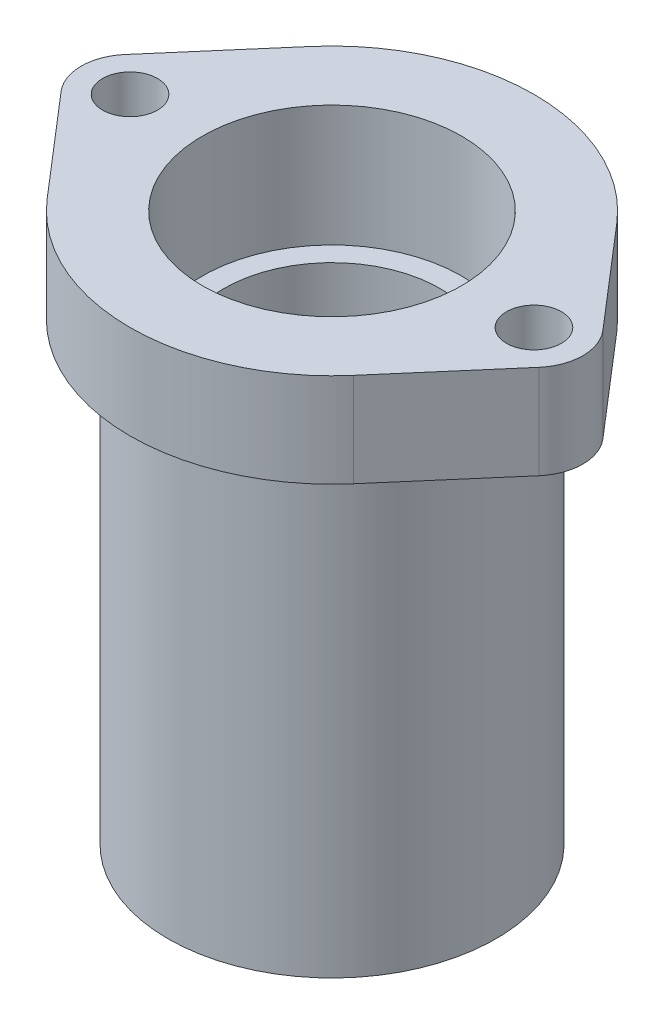
from build123d import *

# Parameters (mm, degrees)
SKETCH1_R           = 1.7272
BOSS_EXTRUDE1_DEPTH = 5.9055
SKETCH2_R           = 10.31875
BOSS_EXTRUDE2_DEPTH = 28.575
SKETCH3_R           = 8.1534
CUT_EXTRUDE1_DEPTH  = 7.62
SKETCH4_R           = 6.7945
CUT_EXTRUDE2_DEPTH  = 16.256
SKETCH5_R           = 5.08
CUT_EXTRUDE3_DEPTH  = 40.987435874


with BuildPart() as part:
    # Sketch1 → Boss-Extrude1 (new body)
    with BuildSketch(Plane(origin=(0, 0, 0), x_dir=(1, 0, 0), z_dir=(0, 1, 0))):
        with BuildLine():
            Line((-15.0296372, 2.004639139), (-9.6266, 8.283632805))
            ThreePointArc((-9.6266, 8.283632805), (0, 12.7), (9.6266, 8.283632805))
            Line((9.6266, 8.283632805), (15.0296372, 2.004639139))
            ThreePointArc((15.0296372, 2.004639139), (15.7734, 0), (15.0296372, -2.004639139))
            Line((15.0296372, -2.004639139), (9.6266, -8.283632805))
            ThreePointArc((9.6266, -8.283632805), (0, -12.7), (-9.6266, -8.283632805))
            Line((-9.6266, -8.283632805), (-15.0296372, -2.004639139))
            ThreePointArc((-15.0296372, -2.004639139), (-15.7734, 0), (-15.0296372, 2.004639139))
        make_face()
        with Locations(Location((-12.7, 0, 0), (0, 0, 270))):
            Circle(SKETCH1_R, mode=Mode.SUBTRACT)
        with Locations(Location((12.7, 0, 0), (0, 0, 270))):
            Circle(SKETCH1_R, mode=Mode.SUBTRACT)
    extrude(amount=BOSS_EXTRUDE1_DEPTH)

    # Sketch2 → Boss-Extrude2 (add)
    with BuildSketch(Plane.XZ):
        with Locations(Location((0, 0, 0), (0, 0, 90))):
            Circle(SKETCH2_R)
    extrude(amount=BOSS_EXTRUDE2_DEPTH)

    # Sketch3 → Cut-Extrude1 (cut)
    with BuildSketch(Plane(origin=(0, 5.9055, 0), x_dir=(1, 0, 0), z_dir=(0, 1, 0))):
        with Locations(Location((0, 0, 0), (0, 0, 270))):
            Circle(SKETCH3_R)
    extrude(amount=-CUT_EXTRUDE1_DEPTH, mode=Mode.SUBTRACT)

    # Sketch4 → Cut-Extrude2 (cut)
    with BuildSketch(Plane(origin=(0, 5.9055, 0), x_dir=(1, 0, 0), z_dir=(0, 1, 0))):
        with Locations(Location((0, 0, 0), (0, 0, 270))):
            Circle(SKETCH4_R)
    extrude(amount=-CUT_EXTRUDE2_DEPTH, mode=Mode.SUBTRACT)

    # Sketch5 → Cut-Extrude3 (cut, through all)
    with BuildSketch(Plane(origin=(0, 5.9055, 0), x_dir=(1, 0, 0), z_dir=(0, 1, 0))):
        with Locations(Location((0, 0, 0), (0, 0, 270))):
            Circle(SKETCH5_R)
    extrude(amount=-CUT_EXTRUDE3_DEPTH, mode=Mode.SUBTRACT)


solid = part.part
